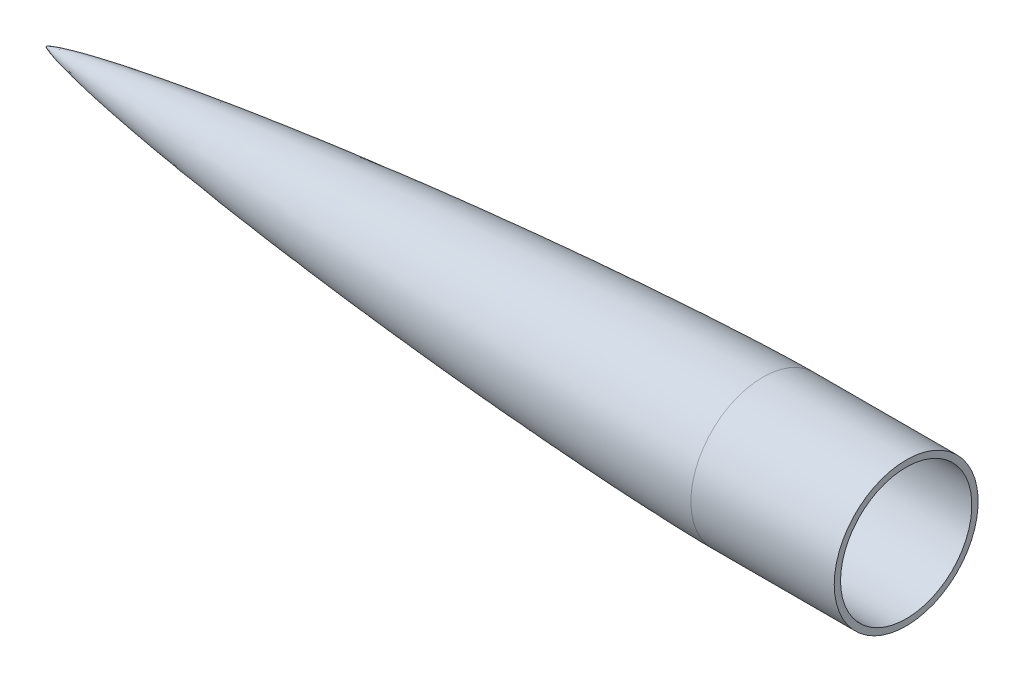
from build123d import *


with BuildPart() as part:
    # Sketch1 → Revolve1 (revolve)
    with BuildSketch(Plane.XY, mode=Mode.PRIVATE) as revolve1_sk:
        with BuildLine():
            Line((158.750341169, 15.935101536), (190.500341169, 15.935101536))
            Line((190.500341169, 15.935101536), (190.500341169, 14.5415))
            Line((190.500341169, 14.5415), (158.75, 14.5415))
            Line((158.75, 14.5415), (158.75, 0))
            Line((158.75, 0), (0, 0))
            add(Edge.make_bspline(
                [(0, 0), (0.003077638, 0.0058499), (0.010509317, 0.016614544), (0.030161895, 0.034492806), (0.069928146, 0.064467314), (0.127121394, 0.09999399), (0.208942402, 0.144612334), (0.324070964, 0.200600292), (0.495029028, 0.275770881), (0.78167404, 0.388965164), (1.293318915, 0.568162571), (2.234449389, 0.85690485), (4.001999256, 1.326179808), (7.08806891, 2.028902418), (12.343697768, 3.058227955), (19.564383665, 4.273011321), (28.320773868, 5.571352366), (38.062563292, 6.865149329), (47.818401435, 8.047201508), (57.585024008, 9.136391169), (67.360274295, 10.144793971), (77.142842464, 11.079522482), (86.931764105, 11.944996551), (99.175054354, 12.942890853), (111.427056111, 13.829066152), (123.686950328, 14.599373054), (135.95442027, 15.235648384), (144.325799069, 15.588495014), (151.25266617, 15.811623372), (155.725298406, 15.904935428), (157.741947303, 15.931595568), (158.750341169, 15.935101536)],
                knots=[0, 0, 0, 0, 0, 0.000164676, 0.000329353, 0.000658706, 0.001247084, 0.001846599, 0.002661643, 0.003861284, 0.00592015, 0.009557354, 0.016225778, 0.028492038, 0.051678343, 0.088753399, 0.150237235, 0.211721064, 0.273204895, 0.334688727, 0.396172559, 0.457656391, 0.519140223, 0.580624055, 0.642107887, 0.765075552, 0.826559383, 0.888043216, 0.949527048, 0.974763524, 1, 1, 1, 1, 1], degree=4))
        make_face()
    revolve(revolve1_sk.sketch.rotate(Axis((0, 0, 0), (1, 0, 0)), 90), axis=Axis((0, 0, 0), (1, 0, 0)))


solid = part.part
